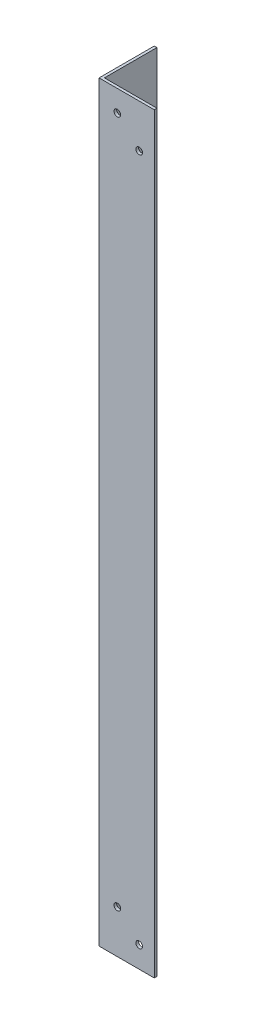
from build123d import *

# Parameters (mm, degrees)
EXTRUDE_1_DEPTH     = 340.5
SKETCH_2_R          = 1.5
CUT_EXTRUDE_1_DEPTH = 343.245073011


with BuildPart() as part:
    # Эскиз1 → Бобышка-Вытянуть1 (new body)
    with BuildSketch(Plane(origin=(0, 0, 0), x_dir=(1, 0, 0), z_dir=(0, 1, 0))):
        Polygon((0, 0), (0, 25), (1.2, 25), (1.2, 1.2), (25, 1.2), (25, 0), align=None)
    extrude(amount=EXTRUDE_1_DEPTH)

    # Эскиз2 → Вырез-Вытянуть1 (cut, through all)
    with BuildSketch(Plane(origin=(0, 0, -1.2), x_dir=(-1, 0, 0), z_dir=(0, 0, -1))):
        with Locations(Location((-8.270505063, 330.863, 0), (0, 0, 180))):
            Circle(SKETCH_2_R)
        with Locations(Location((-18.17, 320.963505063, 0), (0, 0, 180))):
            Circle(SKETCH_2_R)
        with Locations(Location((-8.270505063, 19.536494937, 0), (0, 0, 180))):
            Circle(SKETCH_2_R)
        with Locations(Location((-18.17, 9.637, 0), (0, 0, 180))):
            Circle(SKETCH_2_R)
    extrude(amount=-CUT_EXTRUDE_1_DEPTH, mode=Mode.SUBTRACT)


solid = part.part
